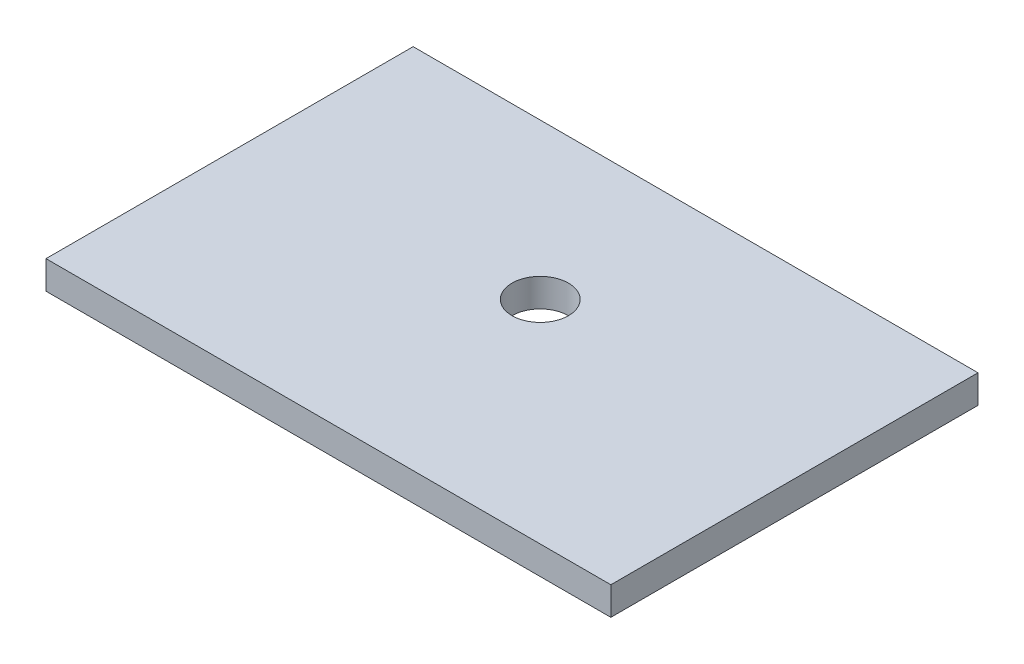
from build123d import *

# Parameters (mm, degrees)
SKETCH1_W           = 200
SKETCH1_H           = 130
SKETCH1_R           = 10
BOSS_EXTRUDE1_DEPTH = 10


with BuildPart() as part:
    # Sketch1 → Boss-Extrude1 (new body)
    with BuildSketch(Plane(origin=(0, 0, 0), x_dir=(1, 0, 0), z_dir=(0, 1, 0))):
        with Locations((100, -65)):
            Rectangle(SKETCH1_W, SKETCH1_H)
        with Locations(Location((100, -55, 0), (0, 0, 270))):
            Circle(SKETCH1_R, mode=Mode.SUBTRACT)
    extrude(amount=BOSS_EXTRUDE1_DEPTH)


solid = part.part
